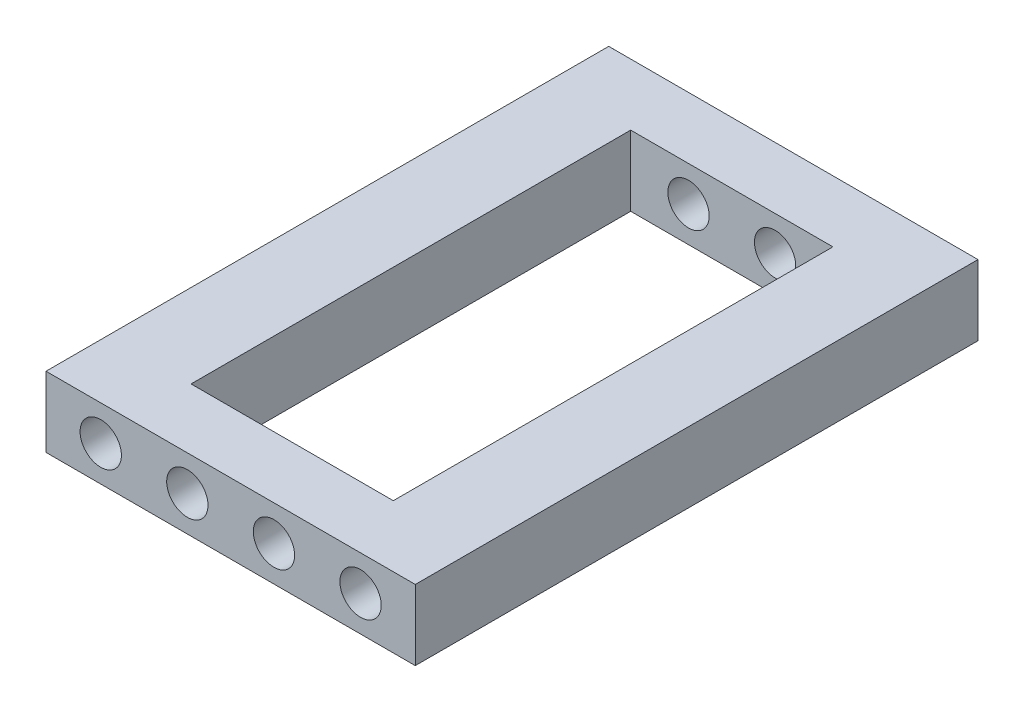
from build123d import *

# Parameters (mm, degrees)
SKETCH_1_W          = 42
SKETCH_1_H          = 8
SKETCH_1_R          = 2.35
EXTRUDE_1_DEPTH     = 32
SKETCH_2_W          = 23
SKETCH_2_H          = 20
CUT_EXTRUDE_2_DEPTH = 14
SKETCH_3_W          = 23
SKETCH_3_H          = 27.182471636
CUT_EXTRUDE_3_DEPTH = 10


with BuildPart() as part:
    # 草图1 → 凸台-拉伸1 (new, symmetric)
    with BuildSketch(Plane.XY):
        Rectangle(SKETCH_1_W, SKETCH_1_H)
        with Locations((-4.925, 0)):
            Circle(SKETCH_1_R, mode=Mode.SUBTRACT)
        with Locations(Location((4.925, 0, 0), (0, 0, 180))):
            Circle(SKETCH_1_R, mode=Mode.SUBTRACT)
        with Locations((-14.775, 0)):
            Circle(SKETCH_1_R, mode=Mode.SUBTRACT)
        with Locations(Location((14.775, 0, 0), (0, 0, 180))):
            Circle(SKETCH_1_R, mode=Mode.SUBTRACT)
    extrude(amount=EXTRUDE_1_DEPTH, both=True)

    # 草图2 → 切除-拉伸2 (cut)
    with BuildSketch(Plane(origin=(0, 4, 0), x_dir=(1, 0, 0), z_dir=(0, 1, 0))):
        with Locations((0, -15)):
            Rectangle(SKETCH_2_W, SKETCH_2_H)
        with Locations((0, 15)):
            Rectangle(SKETCH_2_W, SKETCH_2_H)
    extrude(amount=-CUT_EXTRUDE_2_DEPTH, mode=Mode.SUBTRACT)

    # 草图3 → 切除-拉伸3 (cut)
    with BuildSketch(Plane(origin=(0, 4, 0), x_dir=(1, 0, 0), z_dir=(0, 1, 0))):
        Rectangle(SKETCH_3_W, SKETCH_3_H)
    extrude(amount=-CUT_EXTRUDE_3_DEPTH, mode=Mode.SUBTRACT)


solid = part.part
